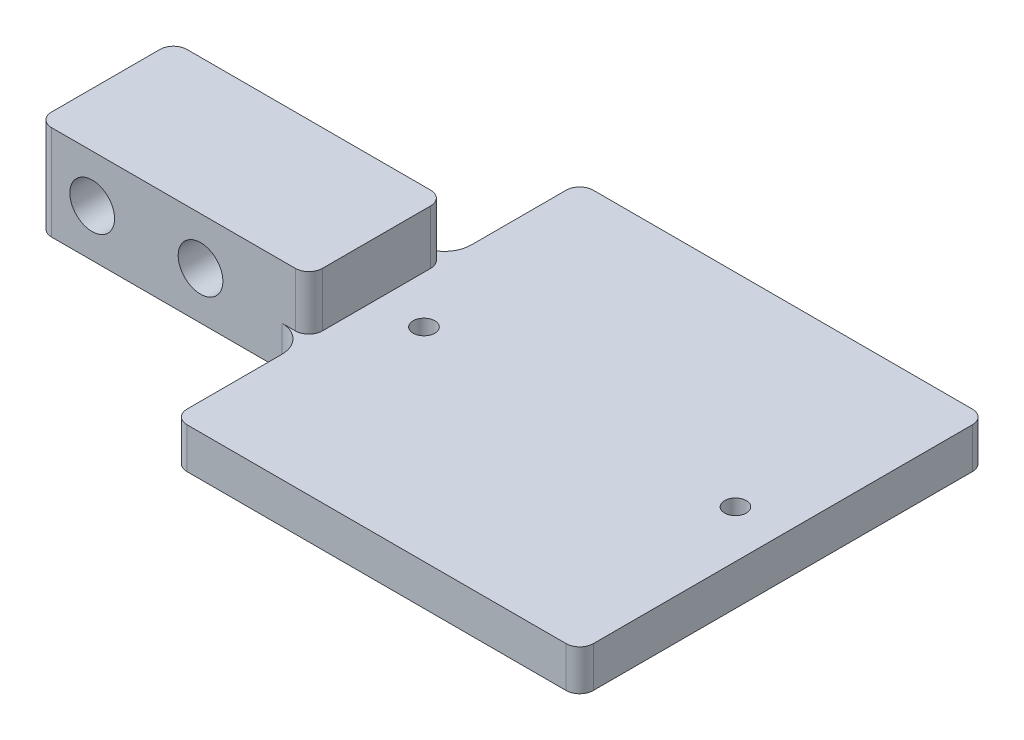
from build123d import *

# Parameters (mm, degrees)
SKETCH1_W             = 30
SKETCH1_H             = 15
BOSS_EXTRUDE1_DEPTH   = 3
SKETCH2_W             = 5
SKETCH2_H             = 7
BOSS_EXTRUDE2_DEPTH   = 20
CUT_EXTRUDE1_DEPTH    = 18
FILLET2_R             = 2
FILLET3_R             = 1
M2X0_4_TAPPED_HOLE1_D = 1.6
M4X0_7_TAPPED_HOLE1_D = 3.3


with BuildPart() as part:
    # Sketch1 → Boss-Extrude1 (new body)
    with BuildSketch(Plane(origin=(0, 0, 0), x_dir=(1, 0, 0), z_dir=(0, 1, 0))):
        with Locations((15, 7.5)):
            Rectangle(SKETCH1_W, SKETCH1_H)
    extrude(amount=BOSS_EXTRUDE1_DEPTH)

    # Sketch2 → Boss-Extrude2 (add)
    with BuildSketch(Plane.ZY):
        with Locations((-12.5, 3.5)):
            Rectangle(SKETCH2_W, SKETCH2_H)
    extrude(amount=BOSS_EXTRUDE2_DEPTH)

    # Sketch3 → Cut-Extrude1 (cut)
    with BuildSketch(Plane.ZY.offset(20)):
        with BuildLine():
            Line((-15, 2), (-15, 5))
            ThreePointArc((-15, 5), (-13.5, 3.5), (-15, 2))
        make_face()
    extrude(amount=-CUT_EXTRUDE1_DEPTH, mode=Mode.SUBTRACT)

    # Mirror1: part across plane


with BuildPart() as part_1:
    add(part.part)
    add(part.part.mirror(Plane(origin=(0, 3, -15), x_dir=(1, 0, 0), z_dir=(0, 0, 1))))

    # Fillet2
    fillet2_edges = [part_1.edges().sort_by_distance(p)[0] for p in [
        (0, 1.5, -10),
        (0, 1.5, -20),
    ]]
    fillet(fillet2_edges, radius=FILLET2_R)

    # Fillet3
    fillet3_edges = [part_1.edges().sort_by_distance(p)[0] for p in [
        (0, 5, -10),
        (-20, 3.5, -10),
        (0, 1.5, -30),
        (30, 1.5, -30),
        (-20, 3.5, -20),
        (0, 5, -20),
        (30, 1.5, 0),
        (0, 1.5, 0),
    ]]
    fillet(fillet3_edges, radius=FILLET3_R)

    # M2x0.4 Tapped Hole1 (through all)
    with Locations(Plane(origin=(3.5, 3, -15), x_dir=(0, 0, 1), z_dir=(0, 1, 0))):
        with Locations((0, 0), (0, 23)):
            Hole(M2X0_4_TAPPED_HOLE1_D / 2)

    # M4x0.7 Tapped Hole1 (through all)
    with Locations(Plane(origin=(-16, 3.5, -10), x_dir=(1, 0, 0), z_dir=(0, 0, 1))):
        with Locations((0, 0), (8, 0)):
            Hole(M4X0_7_TAPPED_HOLE1_D / 2)


solid = part_1.part
